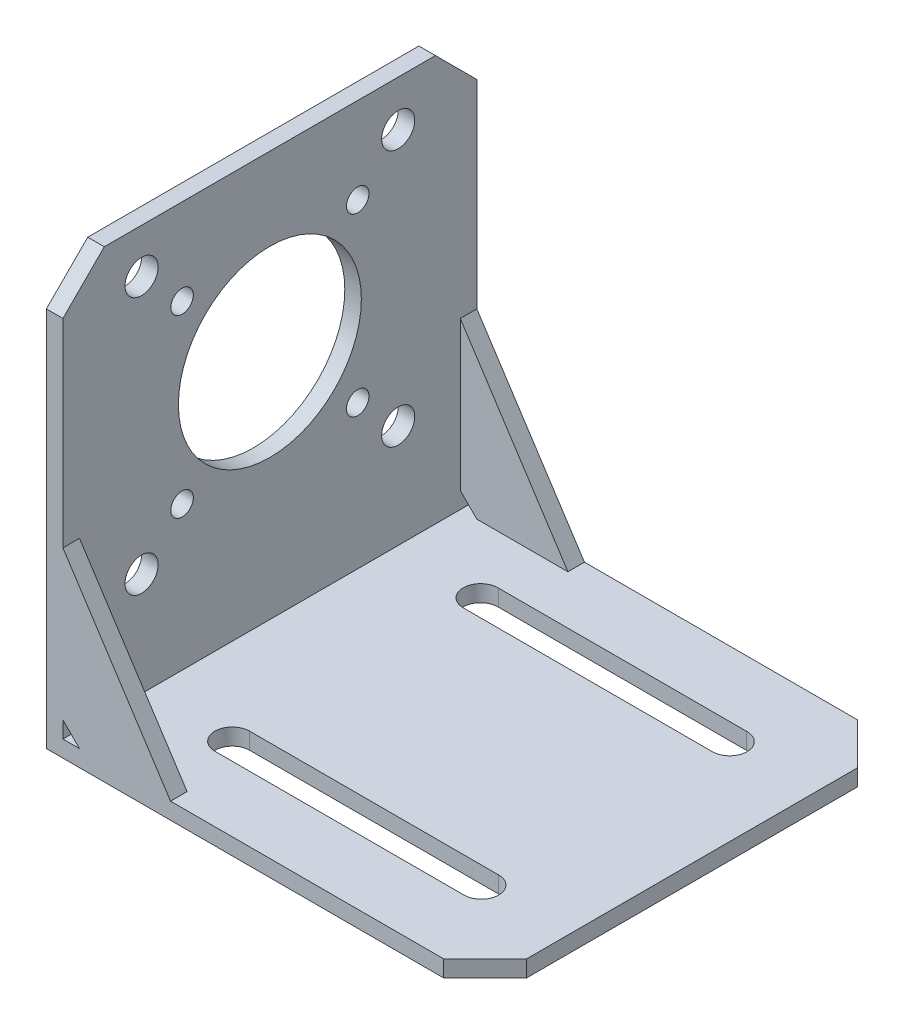
from build123d import *

# Parameters (mm, degrees)
BOSS_EXTRUDE1_DEPTH = 50
SKETCH2_R           = 11.05
SKETCH2_R_2         = 2
CUT_EXTRUDE1_DEPTH  = 88.761039192
CUT_EXTRUDE2_DEPTH  = 50
BOSS_EXTRUDE2_DEPTH = 2
BOSS_EXTRUDE3_DEPTH = 2
CHAMFER1_SIZE       = 5
SKETCH8_R           = 1.3611534
CUT_EXTRUDE3_DEPTH  = 10


with BuildPart() as part:
    # Sketch1 → Boss-Extrude1 (new body)
    with BuildSketch(Plane.XY):
        Polygon((0, 0), (0, 51), (2, 51), (2, 2), (53, 2), (53, 0), align=None)
    extrude(amount=BOSS_EXTRUDE1_DEPTH)

    # Sketch2 → Cut-Extrude1 (cut, through all)
    with BuildSketch(Plane(origin=(2, 0, 0), x_dir=(0, 0, -1), z_dir=(1, 0, 0))):
        with Locations(Location((-25, 30, 0), (0, 0, 90))):
            Circle(SKETCH2_R)
        with Locations(Location((-40.5, 45.640445987, 0), (0, 0, 90))):
            Circle(SKETCH2_R_2)
        with Locations(Location((-9.5, 45.5, 0), (0, 0, 90))):
            Circle(SKETCH2_R_2)
        with Locations(Location((-40.5, 14.5, 0), (0, 0, 90))):
            Circle(SKETCH2_R_2)
        with Locations(Location((-9.5, 14.5, 0), (0, 0, 90))):
            Circle(SKETCH2_R_2)
    extrude(amount=-CUT_EXTRUDE1_DEPTH, mode=Mode.SUBTRACT)

    # Sketch3 → Cut-Extrude2 (cut)
    with BuildSketch(Plane(origin=(0, 2, 0), x_dir=(1, 0, 0), z_dir=(0, 1, 0))):
        with BuildLine():
            Line((12.455251015, -12.1), (42.544748985, -12.1))
            ThreePointArc((42.544748985, -12.1), (44.644629774, -9.977624237), (42.5, -7.900476833))
            Line((42.5, -7.900476833), (12.5, -7.900476833))
            ThreePointArc((12.5, -7.900476833), (10.355370226, -9.977624237), (12.455251015, -12.1))
        make_face()
        with BuildLine():
            Line((12.5, -42.099523167), (42.5, -42.099523167))
            ThreePointArc((42.5, -42.099523167), (44.644629774, -40.022375763), (42.544748985, -37.9))
            Line((42.544748985, -37.9), (12.455251015, -37.9))
            ThreePointArc((12.455251015, -37.9), (10.355370226, -40.022375763), (12.5, -42.099523167))
        make_face()
    extrude(amount=-CUT_EXTRUDE2_DEPTH, mode=Mode.SUBTRACT)

    # Sketch5 → Boss-Extrude2 (add)
    with BuildSketch(Plane.XY.offset(50)):
        Polygon((2, 22), (2, 4), (4, 2), (15, 2), align=None)
    extrude(amount=-BOSS_EXTRUDE2_DEPTH)

    # Sketch6 → Boss-Extrude3 (add)
    with BuildSketch(Plane(origin=(0, 0, 0), x_dir=(-1, 0, 0), z_dir=(0, 0, -1))):
        Polygon((-4, 2), (-2, 4), (-2, 22), (-15, 2), align=None)
    extrude(amount=-BOSS_EXTRUDE3_DEPTH)

    # Chamfer1
    chamfer1_edges = [part.edges().sort_by_distance(p)[0] for p in [
        (1, 51, 50),
        (1, 51, 0),
        (53, 1, 50),
        (53, 1, 0),
    ]]
    chamfer(chamfer1_edges, length=CHAMFER1_SIZE)

    # Sketch8 → Cut-Extrude3 (cut)
    with BuildSketch(Plane.ZY):
        with Locations(Location((35.606601718, 19.393398282, 0), (0, 0, 270))):
            Circle(SKETCH8_R)
        with Locations(Location((14.393398282, 19.393398282, 0), (0, 0, 270))):
            Circle(SKETCH8_R)
        with Locations(Location((14.393398282, 40.606601718, 0), (0, 0, 270))):
            Circle(SKETCH8_R)
        with Locations(Location((35.606601718, 40.606601718, 0), (0, 0, 270))):
            Circle(SKETCH8_R)
    extrude(amount=-CUT_EXTRUDE3_DEPTH, mode=Mode.SUBTRACT)


solid = part.part
